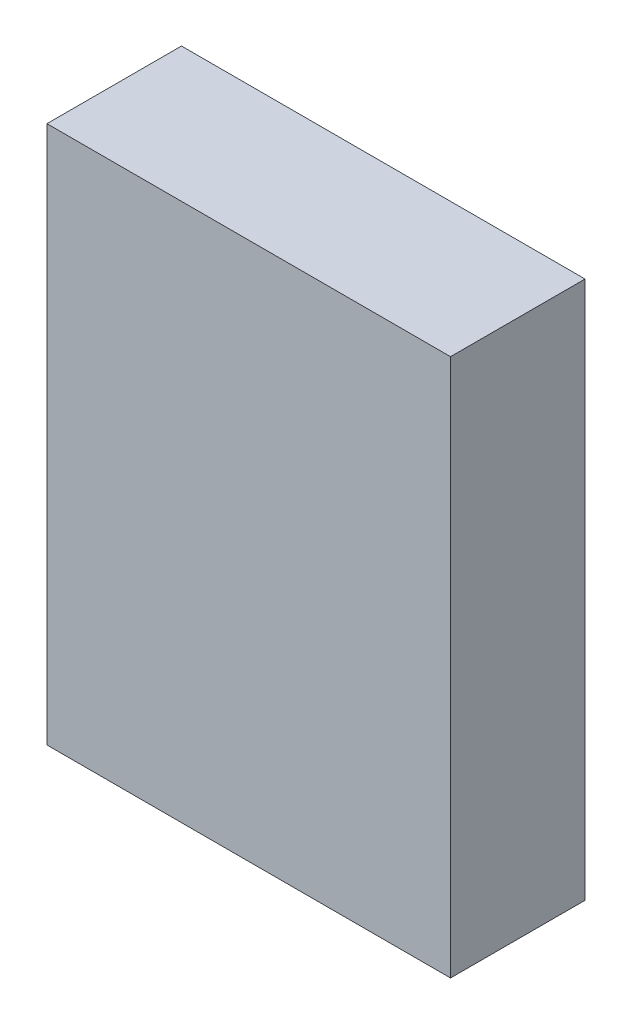
from build123d import *

# Parameters (mm, degrees)
SKETCH1_W     = 6
SKETCH1_H     = 8
PROFILE_DEPTH = 2


with BuildPart() as part:
    # Sketch1 → Profile (new body)
    with BuildSketch(Plane.XY):
        with Locations((3, 4)):
            Rectangle(SKETCH1_W, SKETCH1_H)
    extrude(amount=PROFILE_DEPTH)


solid = part.part
